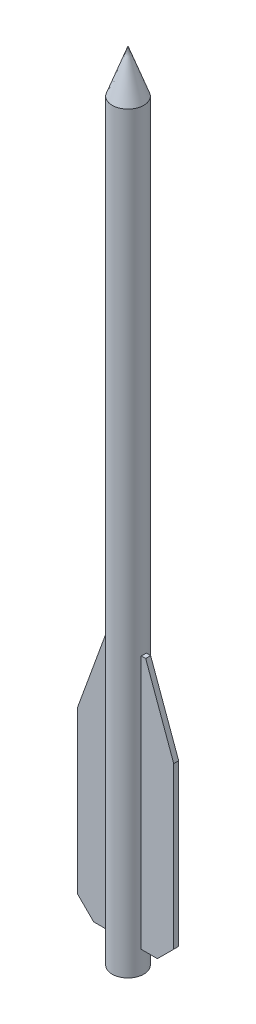
from build123d import *

# Parameters (mm, degrees)
SKETCH1_R           = 3.2
BOSS_EXTRUDE1_DEPTH = 161
CHAMFER1_SIZE       = 3.2
CHAMFER1_SIZE2      = 8.791927742
FLETCHING_DEPTH     = 0.5


with BuildPart() as part:
    # Sketch1 → Boss-Extrude1 (new body)
    with BuildSketch(Plane(origin=(0, 0, 0), x_dir=(1, 0, 0), z_dir=(0, 1, 0))):
        with Locations(Location((0, 0, 0), (0, 0, 270))):
            Circle(SKETCH1_R)
    extrude(amount=BOSS_EXTRUDE1_DEPTH)

    # Chamfer1
    chamfer1_edges = [part.edges().sort_by_distance(p)[0] for p in [
        (0, 161, -3.2),
    ]]
    chamfer1_side = [part.faces().sort_by_distance(p)[0] for p in [
        (0, 161, 0),
    ]]
    chamfer(chamfer1_edges, length=CHAMFER1_SIZE, length2=CHAMFER1_SIZE2, reference=chamfer1_side[0])

    # Sketch2 → Fletching (add, symmetric)
    with BuildSketch(Plane.XY):
        Polygon((0, 4.6), (-6.45, 4.6), (-9.75, 7.9), (-9.75, 40.425060307), (-4.081185551, 56), (0, 56), align=None)
    fletching = extrude(amount=FLETCHING_DEPTH, both=True)

    # Fletchings: Fletching across plane
    add(fletching.mirror(Plane(origin=(0, 0, 0), x_dir=(0, 0, 1), z_dir=(1, 0, 0))))


solid = part.part
